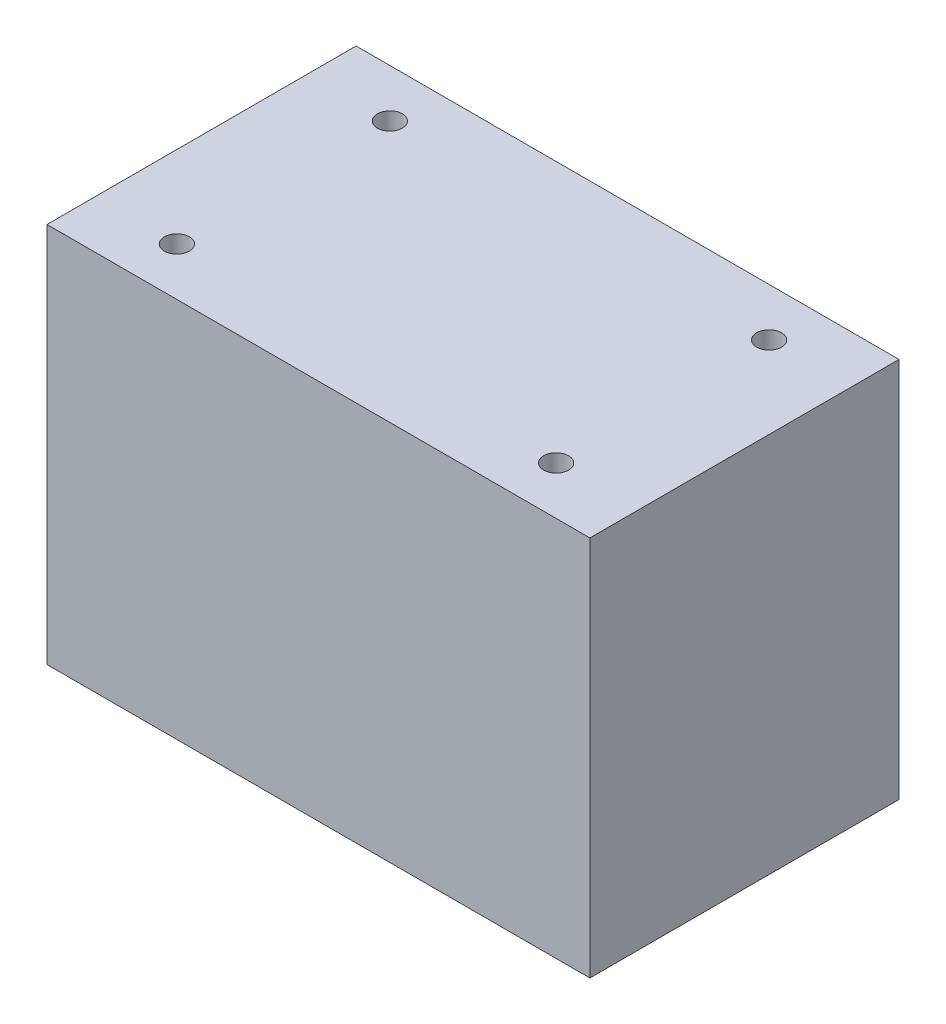
from build123d import *

# Parameters (mm, degrees)
SKETCH1_W                     = 104.5
SKETCH1_H                     = 59.5
BOSS_EXTRUDE1_DEPTH           = 73.36
CBORE_FOR_M4_SHCS2_AT_2_COUNT = 2
CBORE_FOR_M4_SHCS2_AT_2_PITCH = 73
CBORE_FOR_M4_SHCS2_AT_3_COUNT = 2
CBORE_FOR_M4_SHCS2_AT_3_PITCH = 83.725742756
CBORE_FOR_M4_SHCS2_AT_4_COUNT = 2
CBORE_FOR_M4_SHCS2_AT_4_PITCH = 41


with BuildPart() as part:
    # Sketch1 → Boss-Extrude1 (new body)
    with BuildSketch(Plane(origin=(0, 0, 0), x_dir=(1, 0, 0), z_dir=(0, 1, 0))):
        Rectangle(SKETCH1_W, SKETCH1_H)
    extrude(amount=BOSS_EXTRUDE1_DEPTH)

    # Sketch3 → CBORE for M4 SHCS2 (revolve, cut)
    with BuildSketch(Plane(origin=(-36.5, 0, 20.5), x_dir=(0, 0, -1), z_dir=(1, 0, 0))):
        Polygon((0, 0), (0, 73.36), (2.4, 73.36), (2.4, 59), (4, 59), (4, 0.025), (4.025, 0), align=None)
    cbore_for_m4_shcs2 = revolve(axis=Axis((-36.5, -6.35, 20.5), (0, 1, 0)), mode=Mode.SUBTRACT)

    # CBORE for M4 SHCS2 at 2: CBORE for M4 SHCS2 ×2
    with Locations(*[(i * CBORE_FOR_M4_SHCS2_AT_2_PITCH, 0, 0) for i in range(1, CBORE_FOR_M4_SHCS2_AT_2_COUNT)]):
        add(cbore_for_m4_shcs2, mode=Mode.SUBTRACT)

    # CBORE for M4 SHCS2 at 3: CBORE for M4 SHCS2 ×2
    with Locations(*[Vector(0.8718943254163863, 0, -0.48969407317906627) * (i * CBORE_FOR_M4_SHCS2_AT_3_PITCH) for i in range(1, CBORE_FOR_M4_SHCS2_AT_3_COUNT)]):
        add(cbore_for_m4_shcs2, mode=Mode.SUBTRACT)

    # CBORE for M4 SHCS2 at 4: CBORE for M4 SHCS2 ×2
    with Locations(*[(0, 0, -i * CBORE_FOR_M4_SHCS2_AT_4_PITCH) for i in range(1, CBORE_FOR_M4_SHCS2_AT_4_COUNT)]):
        add(cbore_for_m4_shcs2, mode=Mode.SUBTRACT)


solid = part.part
